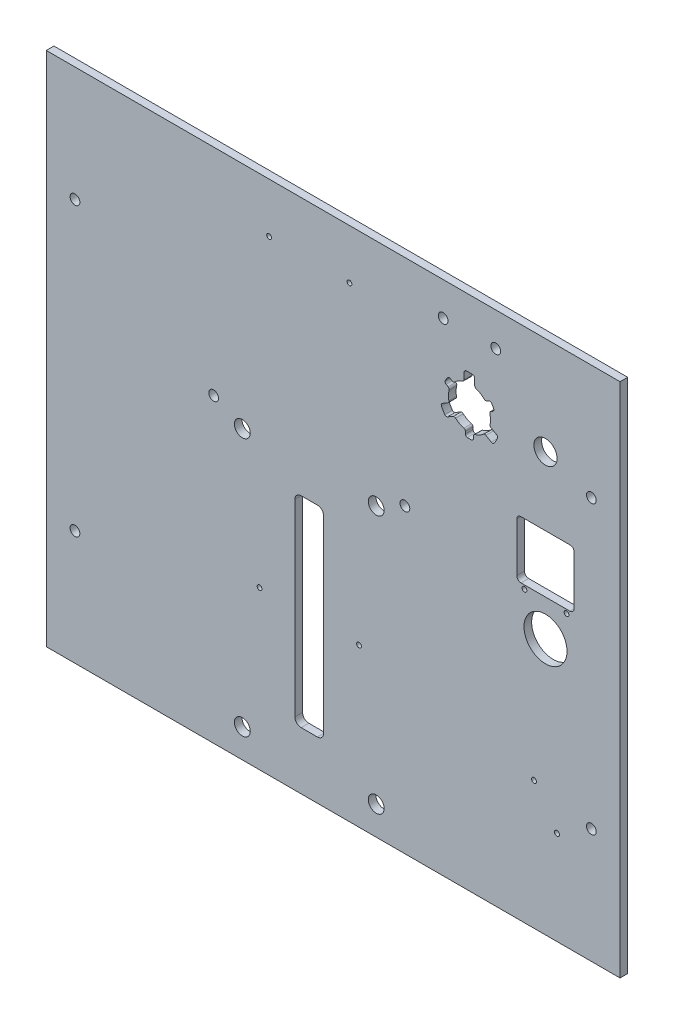
from build123d import *

# Parameters (mm, degrees)
SKIZZE1_W                        = 300
SKIZZE1_H                        = 270
AUFSATZ_LINEAR_AUSTRAGEN1_DEPTH  = 4
F_8_3_8_3_DURCHMESSER_BOHRUNG1_D = 8.3
F_5_1_5_1_DURCHMESSER_BOHRUNG2_D = 5.1
SKIZZE9_W                        = 15
SKIZZE9_H                        = 105
SCHNITT_LINEAR_AUSTRAGEN1_DEPTH  = 11
VERRUNDUNG1_R                    = 3.25
M4_GEWINDEBOHRUNG1_D             = 2.5
SCHNITT_LINEAR_AUSTRAGEN2_DEPTH  = 404.628542103
VERRUNDUNG2_R                    = 1.1
F_5_1_5_1_DURCHMESSER_BOHRUNG1_D = 5.1
SCHNITT_LINEAR_AUSTRAGEN3_REACH  = 405.629
SKIZZE16_R                       = 10.5
SCHNITT_LINEAR_AUSTRAGEN4_REACH  = 405.629
SKIZZE17_R                       = 12
SKIZZE18_R                       = 11.25
SCHNITT_LINEAR_AUSTRAGEN5_DEPTH  = 6.5
SCHNITT_LINEAR_AUSTRAGEN6_DEPTH  = 6
F_2_6_2_6_DURCHMESSER_BOHRUNG1_D = 2.6
SCHNITT_LINEAR_AUSTRAGEN7_REACH  = 405.629
SKIZZE23_R                       = 6.05
M3_GEWINDEBOHRUNG1_D             = 2.5
M3_GEWINDEBOHRUNG1_DEPTH         = 8
M3_GEWINDEBOHRUNG1_TIP           = 0.751075774
M3_GEWINDEBOHRUNG2_D             = 2.5
M3_GEWINDEBOHRUNG2_DEPTH         = 8
M3_GEWINDEBOHRUNG2_TIP           = 0.751075774


with BuildPart() as part:
    # Skizze1 → Aufsatz-Linear austragen1 (new body)
    with BuildSketch(Plane.XY):
        with Locations((150, 135)):
            Rectangle(SKIZZE1_W, SKIZZE1_H)
    extrude(amount=AUFSATZ_LINEAR_AUSTRAGEN1_DEPTH)

    # Ø8.3 (8.3) Durchmesser Bohrung1 (through all)
    with Locations(Plane.XY.offset(4)):
        with Locations((102.5, 15), (172.5, 15), (172.5, 150), (102.5, 150)):
            Hole(F_8_3_8_3_DURCHMESSER_BOHRUNG1_D / 2)

    # Ø5.1 (5.1) Durchmesser Bohrung2 (through all)
    with Locations(Plane(origin=(0, 0, 0), x_dir=(-1, 0, 0), z_dir=(0, 0, -1))):
        with Locations((-235, 252.5), (-87.5, 157.5), (-187.5, 157.5), (-207.5, 252.5)):
            Hole(F_5_1_5_1_DURCHMESSER_BOHRUNG2_D / 2)

    # Skizze9 → Schnitt-Linear austragen1 (cut)
    with BuildSketch(Plane.XY.offset(4)):
        with Locations((137.5, 82.5)):
            Rectangle(SKIZZE9_W, SKIZZE9_H)
    extrude(amount=-SCHNITT_LINEAR_AUSTRAGEN1_DEPTH, mode=Mode.SUBTRACT)

    # Verrundung1
    verrundung1_edges = [part.edges().sort_by_distance(p)[0] for p in [
        (145, 135, 2),
        (145, 30, 2),
        (130, 30, 2),
        (130, 135, 2),
    ]]
    fillet(verrundung1_edges, radius=VERRUNDUNG1_R)

    # M4 Gewindebohrung1 (through all)
    with Locations(Plane(origin=(0, 0, 0), x_dir=(-1, 0, 0), z_dir=(0, 0, -1))):
        with Locations((-158.5, 244), (-116.5, 244)):
            Hole(M4_GEWINDEBOHRUNG1_D / 2)

    # Skizze14 → Schnitt-Linear austragen2 (cut, through all)
    with BuildSketch(Plane.XY.offset(4)):
        with BuildLine():
            Line((234.296375886, 223.828589986), (231.659332685, 222.306092384))
            ThreePointArc((231.659332685, 222.306092384), (232.245330666, 219.070473927), (231.848780407, 215.806217759))
            Line((231.848780407, 215.806217759), (236.275206042, 213.250619727))
            ThreePointArc((236.275206042, 213.250619727), (235.106406461, 210.75), (233.525206042, 208.487480007))
            Line((233.525206042, 208.487480007), (229.098780407, 211.043078039))
            ThreePointArc((229.098780407, 211.043078039), (226.470126771, 209.067527357), (223.375, 207.957207266))
            Line((223.375, 207.957207266), (223.375, 204.912212063))
            ThreePointArc((223.375, 204.912212063), (221.25, 204.75), (219.125, 204.912212063))
            Line((219.125, 204.912212063), (219.125, 207.957207266))
            ThreePointArc((219.125, 207.957207266), (216.029873229, 209.067527357), (213.401219593, 211.043078039))
            Line((213.401219593, 211.043078039), (208.974793958, 208.487480007))
            ThreePointArc((208.974793958, 208.487480007), (207.393593539, 210.75), (206.224793958, 213.250619727))
            Line((206.224793958, 213.250619727), (210.651219593, 215.806217759))
            ThreePointArc((210.651219593, 215.806217759), (210.254669334, 219.070473927), (210.840667315, 222.306092384))
            Line((210.840667315, 222.306092384), (208.203624114, 223.828589986))
            ThreePointArc((208.203624114, 223.828589986), (209.125644347, 225.75), (210.328624114, 227.509197952))
            Line((210.328624114, 227.509197952), (212.965667315, 225.98670035))
            ThreePointArc((212.965667315, 225.98670035), (215.474796105, 228.111998717), (218.5, 229.400704202))
            Line((218.5, 229.400704202), (218.5, 234.511900266))
            ThreePointArc((218.5, 234.511900266), (221.25, 234.75), (224, 234.511900266))
            Line((224, 234.511900266), (224, 229.400704202))
            ThreePointArc((224, 229.400704202), (227.025203895, 228.111998717), (229.534332685, 225.98670035))
            Line((229.534332685, 225.98670035), (232.171375886, 227.509197952))
            ThreePointArc((232.171375886, 227.509197952), (233.374355653, 225.75), (234.296375886, 223.828589986))
        make_face()
    extrude(amount=-SCHNITT_LINEAR_AUSTRAGEN2_DEPTH, mode=Mode.SUBTRACT)

    # Verrundung2
    verrundung2_edges = [part.edges().sort_by_distance(p)[0] for p in [
        (224, 229.400704202, 2),
        (229.534332685, 225.98670035, 2),
        (232.171375886, 227.509197952, 2),
        (234.296375886, 223.828589986, 2),
        (231.659332685, 222.306092384, 2),
        (231.848780407, 215.806217759, 2),
        (236.275206042, 213.250619727, 2),
        (233.525206042, 208.487480007, 2),
        (229.098780407, 211.043078039, 2),
        (223.375, 207.957207266, 2),
        (223.375, 204.912212063, 2),
        (219.125, 204.912212063, 2),
        (219.125, 207.957207266, 2),
        (213.401219593, 211.043078039, 2),
        (208.974793958, 208.487480007, 2),
        (206.224793958, 213.250619727, 2),
        (210.651219593, 215.806217759, 2),
        (210.840667315, 222.306092384, 2),
        (208.203624114, 223.828589986, 2),
        (210.328624114, 227.509197952, 2),
        (212.965667315, 225.98670035, 2),
        (218.5, 229.400704202, 2),
        (218.5, 234.511900266, 2),
        (224, 234.511900266, 2),
    ]]
    fillet(verrundung2_edges, radius=VERRUNDUNG2_R)

    # Ø5.1 (5.1) Durchmesser Bohrung1 (through all)
    with Locations(Plane(origin=(285, 210, 0), x_dir=(-1, 0, 0), z_dir=(0, 0, -1))):
        with Locations((0, 0), (0, -150), (270, 0), (270, -150)):
            Hole(F_5_1_5_1_DURCHMESSER_BOHRUNG1_D / 2)

    # Skizze16 → Schnitt-Linear austragen3 (cut, up to next)
    with BuildSketch(Plane(origin=(0, 0, 0), x_dir=(-1, 0, 0), z_dir=(0, 0, -1)), mode=Mode.PRIVATE) as schnitt_linear_austragen3_sk1:
        with Locations((-261, 134)):
            Circle(SKIZZE16_R)
    schnitt_linear_austragen3_tool1 = extrude(schnitt_linear_austragen3_sk1.sketch, amount=-SCHNITT_LINEAR_AUSTRAGEN3_REACH, mode=Mode.PRIVATE) & part.part
    add(schnitt_linear_austragen3_tool1.solids().sort_by_distance((261, 134, 0))[0], mode=Mode.SUBTRACT)

    # Skizze17 → Schnitt-Linear austragen4 (cut, up to next)
    with BuildSketch(Plane(origin=(0, 0, 0), x_dir=(-1, 0, 0), z_dir=(0, 0, -1)), mode=Mode.PRIVATE) as schnitt_linear_austragen4_sk1:
        with Locations((-261, 168)):
            Circle(SKIZZE17_R)
    schnitt_linear_austragen4_tool1 = extrude(schnitt_linear_austragen4_sk1.sketch, amount=-SCHNITT_LINEAR_AUSTRAGEN4_REACH, mode=Mode.PRIVATE) & part.part
    add(schnitt_linear_austragen4_tool1.solids().sort_by_distance((261, 168, 0))[0], mode=Mode.SUBTRACT)

    # Skizze18 → Schnitt-Linear austragen5 (cut)
    with BuildSketch(Plane.XY.offset(4)):
        with Locations((261, 134)):
            Circle(SKIZZE18_R)
    extrude(amount=-SCHNITT_LINEAR_AUSTRAGEN5_DEPTH, mode=Mode.SUBTRACT)

    # Skizze19 → Schnitt-Linear austragen6 (cut)
    with BuildSketch(Plane.XY.offset(4)):
        with BuildLine():
            Line((248.2, 183), (273.8, 183))
            ThreePointArc((273.8, 183), (275.355634919, 182.355634919), (276, 180.8))
            Line((276, 180.8), (276, 155.2))
            ThreePointArc((276, 155.2), (275.355634919, 153.644365081), (273.8, 153))
            Line((273.8, 153), (248.2, 153))
            ThreePointArc((248.2, 153), (246.644365081, 153.644365081), (246, 155.2))
            Line((246, 155.2), (246, 180.8))
            ThreePointArc((246, 180.8), (246.644365081, 182.355634919), (248.2, 183))
        make_face()
    extrude(amount=-SCHNITT_LINEAR_AUSTRAGEN6_DEPTH, mode=Mode.SUBTRACT)

    # Ø2.6 (2.6) Durchmesser Bohrung1 (through all)
    with Locations(Plane(origin=(0, 0, 0), x_dir=(-1, 0, 0), z_dir=(0, 0, -1))):
        with Locations((-255, 67), (-267, 49)):
            Hole(F_2_6_2_6_DURCHMESSER_BOHRUNG1_D / 2)

    # Skizze23 → Schnitt-Linear austragen7 (cut, up to next)
    with BuildSketch(Plane(origin=(0, 0, 0), x_dir=(-1, 0, 0), z_dir=(0, 0, -1)), mode=Mode.PRIVATE) as schnitt_linear_austragen7_sk1:
        with Locations((-261, 218.75)):
            Circle(SKIZZE23_R)
    schnitt_linear_austragen7_tool1 = extrude(schnitt_linear_austragen7_sk1.sketch, amount=-SCHNITT_LINEAR_AUSTRAGEN7_REACH, mode=Mode.PRIVATE) & part.part
    add(schnitt_linear_austragen7_tool1.solids().sort_by_distance((261, 218.75, 0))[0], mode=Mode.SUBTRACT)

    # M3 Gewindebohrung1
    with Locations(Plane.XY.offset(4)):
        with Locations((250, 151), (272, 151)):
            Hole(M3_GEWINDEBOHRUNG1_D / 2, depth=M3_GEWINDEBOHRUNG1_DEPTH)
            with Locations((0, 0, -(M3_GEWINDEBOHRUNG1_DEPTH + M3_GEWINDEBOHRUNG1_TIP / 2))):  # 118° drill point
                Cone(0, M3_GEWINDEBOHRUNG1_D / 2, M3_GEWINDEBOHRUNG1_TIP, mode=Mode.SUBTRACT)

    # M3 Gewindebohrung2
    with Locations(Plane(origin=(0, 0, 0), x_dir=(-1, 0, 0), z_dir=(0, 0, -1))):
        with Locations((-163.5, 82.5), (-111.5, 82.5)):
            Hole(M3_GEWINDEBOHRUNG2_D / 2, depth=M3_GEWINDEBOHRUNG2_DEPTH)
            with Locations((0, 0, -(M3_GEWINDEBOHRUNG2_DEPTH + M3_GEWINDEBOHRUNG2_TIP / 2))):  # 118° drill point
                Cone(0, M3_GEWINDEBOHRUNG2_D / 2, M3_GEWINDEBOHRUNG2_TIP, mode=Mode.SUBTRACT)


solid = part.part
